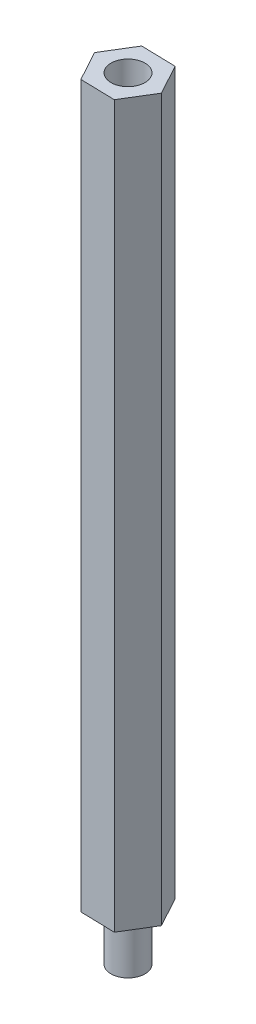
from build123d import *

# Parameters (mm, degrees)
EXTRUDE_1_DEPTH     = 85
SKETCH_2_R          = 2
CUT_EXTRUDE_1_DEPTH = 8
SKETCH_3_R          = 2
EXTRUDE_2_DEPTH     = 6


with BuildPart() as part:
    # 스케치1 → 보스-돌출1 (new body)
    with BuildSketch(Plane(origin=(0, 0, 0), x_dir=(1, 0, 0), z_dir=(0, 1, 0))):
        Polygon((1.931599116, -3.549965942), (4.040160246, -0.102169067), (2.108561131, 3.447796875), (-1.931599116, 3.549965942), (-4.040160246, 0.102169067), (-2.108561131, -3.447796875), align=None)
    extrude(amount=EXTRUDE_1_DEPTH)

    # 스케치2 → 컷-돌출1 (cut)
    with BuildSketch(Plane(origin=(0, 85, 0), x_dir=(1, 0, 0), z_dir=(0, 1, 0))):
        with Locations(Location((0, 0, 0), (0, 0, 270))):
            Circle(SKETCH_2_R)
    extrude(amount=-CUT_EXTRUDE_1_DEPTH, mode=Mode.SUBTRACT)

    # 스케치3 → 보스-돌출2 (add)
    with BuildSketch(Plane.XZ):
        with Locations(Location((0, 0, 0), (0, 0, 90))):
            Circle(SKETCH_3_R)
    extrude(amount=EXTRUDE_2_DEPTH)


solid = part.part
